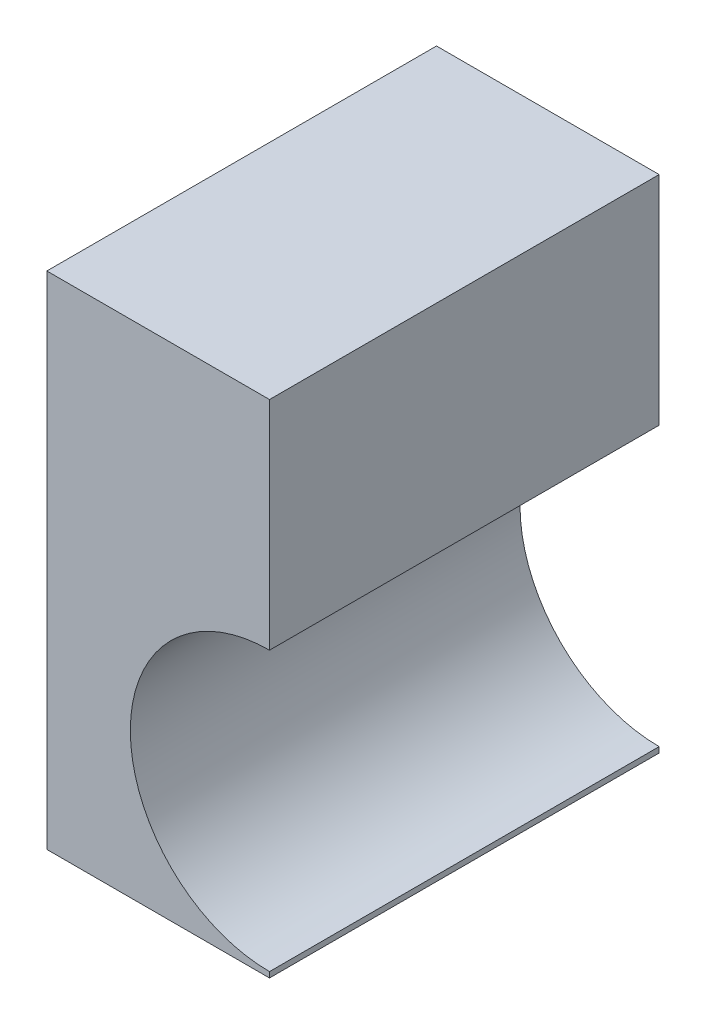
from build123d import *

# Parameters (mm, degrees)
BOSS_EXTRUDE1_DEPTH = 35


with BuildPart() as part:
    # Sketch1 → Boss-Extrude1 (new body)
    with BuildSketch(Plane.XY):
        with BuildLine():
            Line((0, 0), (0, 0.5))
            ThreePointArc((0, 0.5), (-12.5, 13), (0, 25.5))
            Line((0, 25.5), (0, 45))
            Line((0, 45), (-20, 45))
            Line((-20, 45), (-20, 0))
            Line((-20, 0), (0, 0))
        make_face()
    extrude(amount=BOSS_EXTRUDE1_DEPTH)


solid = part.part
